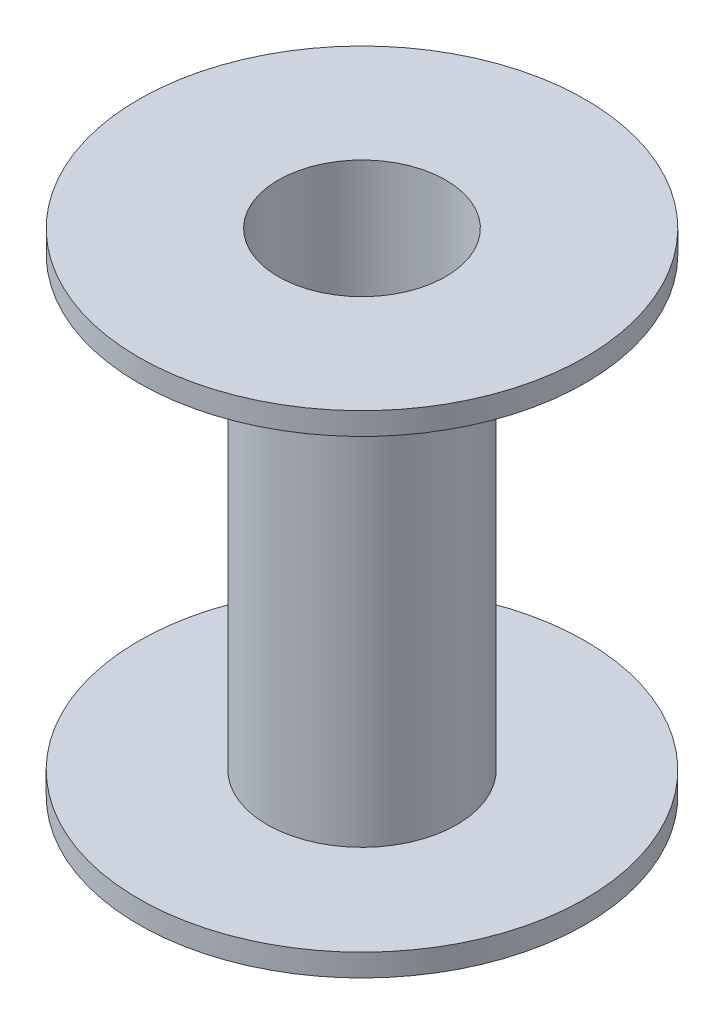
from build123d import *

# Parameters (mm, degrees)
SKETCH3_R           = 4.25
SKETCH3_R_2         = 3.75
BOSS_EXTRUDE1_DEPTH = 20
SKETCH21_R          = 10
BOSS_EXTRUDE2_DEPTH = 1
SKETCH29_R          = 1.75
CUT_EXTRUDE6_DEPTH  = 8.3
BOSS_EXTRUDE5_START = 1
SKETCH33_R          = 10
BOSS_EXTRUDE5_DEPTH = 1
SKETCH35_R          = 3.75
CUT_EXTRUDE8_DEPTH  = 27.153393661


with BuildPart() as part:
    # Sketch3 → Boss-Extrude1 (new body)
    with BuildSketch(Plane(origin=(0, 0, 0), x_dir=(1, 0, 0), z_dir=(0, 1, 0))):
        with Locations(Location((0, 0, 0), (0, 0, 270))):
            Circle(SKETCH3_R)
        with Locations(Location((0, 0, 0), (0, 0, 270))):
            Circle(SKETCH3_R_2, mode=Mode.SUBTRACT)
    extrude(amount=BOSS_EXTRUDE1_DEPTH)

    # Sketch21 → Boss-Extrude2 (add)
    with BuildSketch(Plane(origin=(0, 20, 0), x_dir=(1, 0, 0), z_dir=(0, 1, 0))):
        with Locations(Location((0, 0, 0), (0, 0, 270))):
            Circle(SKETCH21_R)
    extrude(amount=BOSS_EXTRUDE2_DEPTH)

    # Sketch29 → Cut-Extrude6 (cut)
    with BuildSketch(Plane(origin=(0, 21, 0), x_dir=(1, 0, 0), z_dir=(0, 1, 0))):
        with Locations(Location((0, 0, 0), (0, 0, 270))):
            Circle(SKETCH29_R)
    extrude(amount=-CUT_EXTRUDE6_DEPTH, mode=Mode.SUBTRACT)

    # Sketch33 → Boss-Extrude5 (add)
    with BuildSketch(Plane.XZ.offset(BOSS_EXTRUDE5_START)):
        with Locations(Location((0, 0, 0), (0, 0, 90))):
            Circle(SKETCH33_R)
    extrude(amount=-BOSS_EXTRUDE5_DEPTH)

    # Sketch35 → Cut-Extrude8 (cut, through all)
    with BuildSketch(Plane.XZ.offset(1)):
        with Locations(Location((0, 0, 0), (0, 0, 270))):
            Circle(SKETCH35_R)
    extrude(amount=-CUT_EXTRUDE8_DEPTH, mode=Mode.SUBTRACT)


solid = part.part
